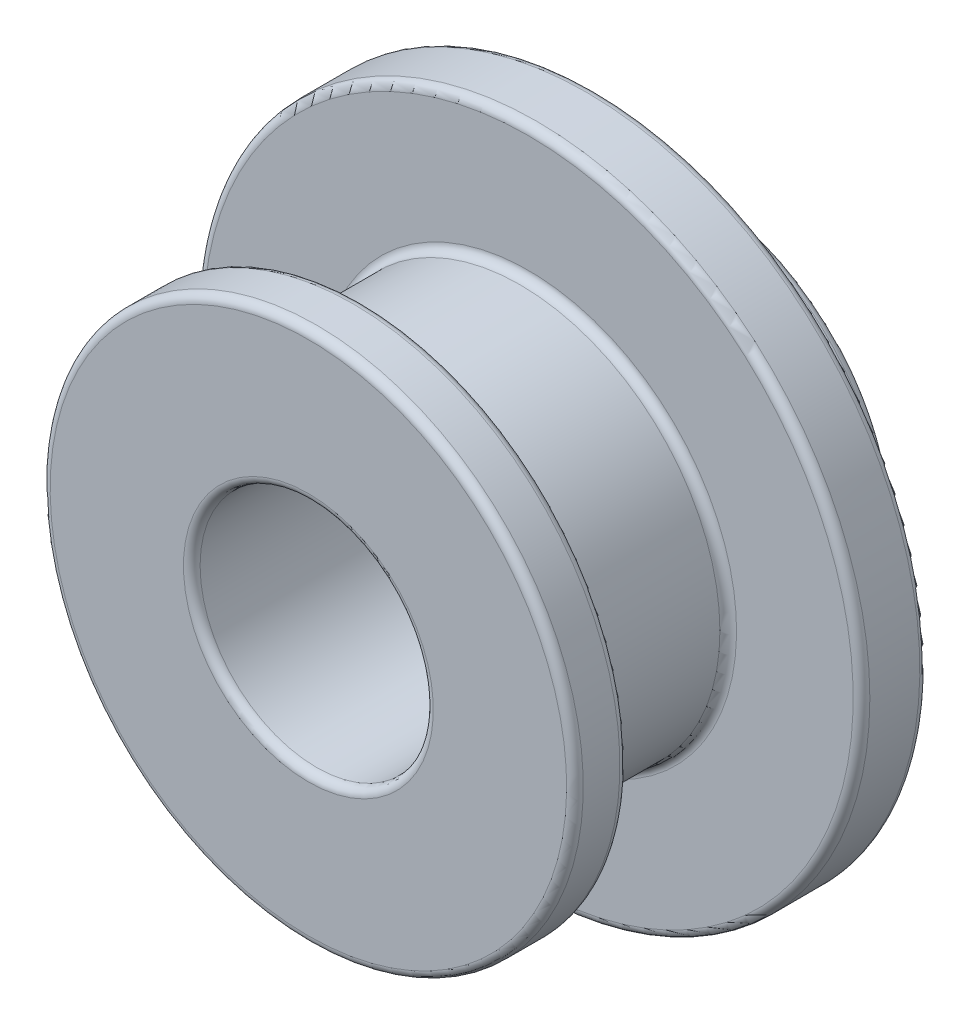
from build123d import *

# Parameters (mm, degrees)
M6X1_0_TAPPED_HOLE1_D = 5
FILLET1_R             = 0.25


with BuildPart() as part:
    # Sketch1 → Revolve1 (revolve)
    with BuildSketch(Plane(origin=(0, 0, 0), x_dir=(0, 0, -1), z_dir=(1, 0, 0))):
        Polygon((0, 8), (0, 6), (5, 6), (5, 10), (7, 10), (7, 6), (10, 6), (10, 0), (5, 0), (5, 3.5), (-1.6, 3.5), (-1.6, 8), align=None)
    revolve(axis=Axis((0, 0, -10), (0, 0, 1)))

    # M6x1.0 Tapped Hole1 (through all)
    with Locations(Plane.XY.offset(-5)):
        with Locations((0, 0)):
            Hole(M6X1_0_TAPPED_HOLE1_D / 2)

    # Fillet1
    fillet1_edges = [part.edges().sort_by_distance(p)[0] for p in [
        (0, -6, -10),
        (0, -6, -7),
        (0, -10, -7),
        (0, -10, -5),
        (0, -6, -5),
        (0, -6, 0),
        (0, -8, 0),
        (0, -8, 1.6),
        (0, -3.5, 1.6),
    ]]
    fillet(fillet1_edges, radius=FILLET1_R)


solid = part.part
